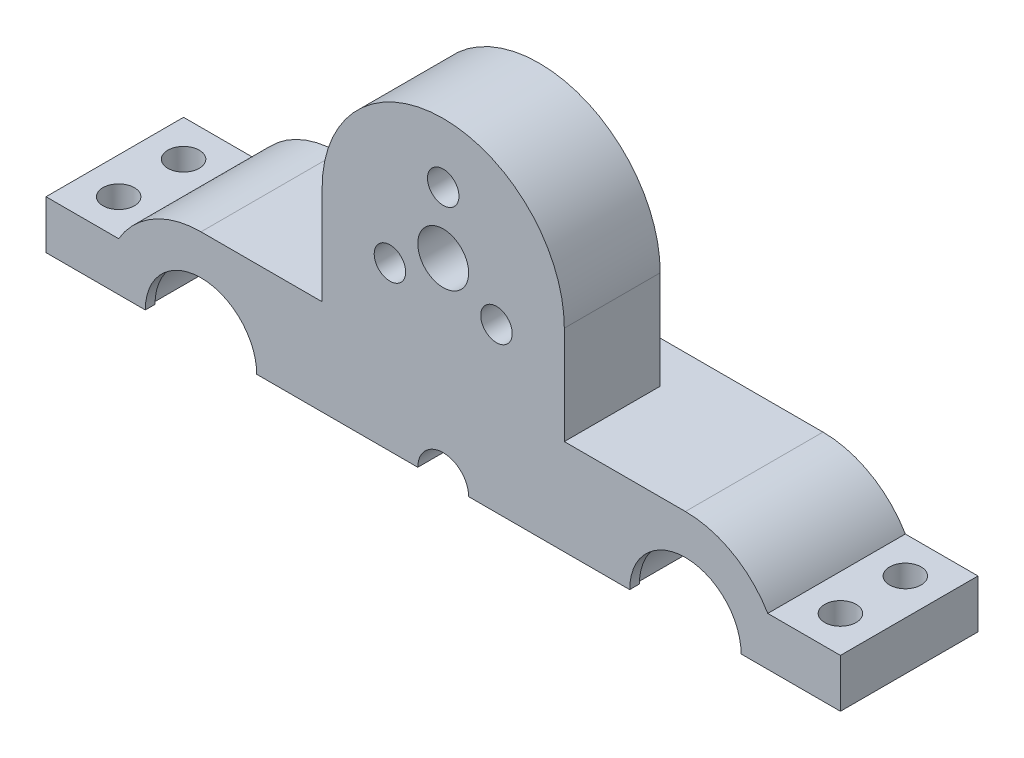
from build123d import *

# Parameters (mm, degrees)
SKETCH1_W           = 82
SKETCH1_H           = 25
BOSS_EXTRUDE1_DEPTH = 14.2
CUT_EXTRUDE3_DEPTH  = 14.2
BOSS_EXTRUDE2_DEPTH = 1
BOSS_EXTRUDE3_START = -13.2
BOSS_EXTRUDE3_DEPTH = 1
CUT_EXTRUDE4_START  = -6.45
CUT_EXTRUDE4_DEPTH  = 3.25
CUT_EXTRUDE5_DEPTH  = 4.5
CUT_EXTRUDE6_DEPTH  = 14.2
SKETCH8_R           = 1.625
CUT_EXTRUDE7_DEPTH  = 5
SKETCH10_W          = 25
SKETCH10_H          = 10.138458538
BOSS_EXTRUDE4_DEPTH = 9.9
SKETCH11_R          = 9.75
CUT_EXTRUDE8_DEPTH  = 4
SKETCH12_R          = 1.625
CUT_EXTRUDE9_DEPTH  = 5.9
CIRPATTERN1_COUNT   = 3
SKETCH13_R          = 2.625
CUT_EXTRUDE10_DEPTH = 5.9


with BuildPart() as part:
    # Sketch1 → Boss-Extrude1 (new body)
    with BuildSketch(Plane.XY):
        with Locations((0, 12.5)):
            Rectangle(SKETCH1_W, SKETCH1_H)
    extrude(amount=BOSS_EXTRUDE1_DEPTH)

    # Sketch2 → Cut-Extrude3 (cut)
    with BuildSketch(Plane(origin=(0, 0, 0), x_dir=(-1, 0, 0), z_dir=(0, 0, -1))):
        with BuildLine():
            Line((-31, 0), (-19, 0))
            ThreePointArc((-19, 0), (-25, 6), (-31, 0))
        make_face()
        with BuildLine():
            Line((19, 0), (31, 0))
            ThreePointArc((31, 0), (25, 6), (19, 0))
        make_face()
    extrude(amount=-CUT_EXTRUDE3_DEPTH, mode=Mode.SUBTRACT)

    # Sketch4 → Boss-Extrude2 (add)
    with BuildSketch(Plane(origin=(0, 0, 0), x_dir=(-1, 0, 0), z_dir=(0, 0, -1))):
        with BuildLine():
            Line((-30.75, 0), (-31, 0))
            ThreePointArc((-31, 0), (-25, 6), (-19, 0))
            Line((-19, 0), (-19.25, 0))
            ThreePointArc((-19.25, 0), (-25, 5.75), (-30.75, 0))
        make_face()
        with BuildLine():
            Line((19, 0), (19.25, 0))
            ThreePointArc((19.25, 0), (25, 5.75), (30.75, 0))
            Line((30.75, 0), (31, 0))
            ThreePointArc((31, 0), (25, 6), (19, 0))
        make_face()
    extrude(amount=-BOSS_EXTRUDE2_DEPTH)

    # Sketch4<2> → Boss-Extrude3 (add)
    with BuildSketch(Plane(origin=(0, 0, 0), x_dir=(-1, 0, 0), z_dir=(0, 0, -1)).offset(BOSS_EXTRUDE3_START)):
        with BuildLine():
            Line((-30.75, 0), (-31, 0))
            ThreePointArc((-31, 0), (-25, 6), (-19, 0))
            Line((-19, 0), (-19.25, 0))
            ThreePointArc((-19.25, 0), (-25, 5.75), (-30.75, 0))
        make_face()
        with BuildLine():
            Line((19, 0), (19.25, 0))
            ThreePointArc((19.25, 0), (25, 5.75), (30.75, 0))
            Line((30.75, 0), (31, 0))
            ThreePointArc((31, 0), (25, 6), (19, 0))
        make_face()
    extrude(amount=-BOSS_EXTRUDE3_DEPTH)

    # Sketch5 → Cut-Extrude4 (cut)
    with BuildSketch(Plane(origin=(0, 0, 0), x_dir=(-1, 0, 0), z_dir=(0, 0, -1)).offset(CUT_EXTRUDE4_START)):
        with BuildLine():
            Line((-6.5, 0), (6.5, 0))
            ThreePointArc((6.5, 0), (0, 6.5), (-6.5, 0))
        make_face()
    extrude(amount=-CUT_EXTRUDE4_DEPTH, mode=Mode.SUBTRACT)

    # Sketch6 → Cut-Extrude5 (cut)
    with BuildSketch(Plane(origin=(0, 0, 14.2), x_dir=(-1, 0, 0), z_dir=(0, 0, -1))):
        with BuildLine():
            Line((-2.625, 0), (2.625, 0))
            ThreePointArc((2.625, 0), (0, 2.625), (-2.625, 0))
        make_face()
    extrude(amount=CUT_EXTRUDE5_DEPTH, mode=Mode.SUBTRACT)

    # Sketch7 → Cut-Extrude6 (cut)
    with BuildSketch(Plane(origin=(0, 0, 0), x_dir=(-1, 0, 0), z_dir=(0, 0, -1))):
        with BuildLine():
            Line((-41, 5), (-33.5, 5))
            ThreePointArc((-33.5, 5), (-29.896033736, 8.560306867), (-25, 9.861541462))
            Line((-25, 9.861541462), (25, 9.861541462))
            ThreePointArc((25, 9.861541462), (29.896033736, 8.560306867), (33.5, 5))
            Line((33.5, 5), (41, 5))
            Line((41, 5), (41, 25))
            Line((41, 25), (-41, 25))
            Line((-41, 25), (-41, 5))
        make_face()
    extrude(amount=-CUT_EXTRUDE6_DEPTH, mode=Mode.SUBTRACT)

    # Sketch8 → Cut-Extrude7 (cut)
    with BuildSketch(Plane(origin=(0, 5, 0), x_dir=(1, 0, 0), z_dir=(0, 1, 0))):
        with Locations(Location((37.25, -3.75, 0), (0, 0, 270))):
            Circle(SKETCH8_R)
        with Locations(Location((37.25, -10.45, 0), (0, 0, 270))):
            Circle(SKETCH8_R)
        with Locations(Location((-37.25, -3.75, 0), (0, 0, 270))):
            Circle(SKETCH8_R)
        with Locations(Location((-37.25, -10.45, 0), (0, 0, 270))):
            Circle(SKETCH8_R)
    extrude(amount=-CUT_EXTRUDE7_DEPTH, mode=Mode.SUBTRACT)

    # Sketch10 → Boss-Extrude4 (add)
    with BuildSketch(Plane.XY.offset(14.2)):
        with Locations((0, 14.930770731)):
            Rectangle(SKETCH10_W, SKETCH10_H)
        with BuildLine():
            Line((-12.5, 20), (12.5, 20))
            ThreePointArc((12.5, 20), (0, 32.5), (-12.5, 20))
        make_face()
    extrude(amount=-BOSS_EXTRUDE4_DEPTH)

    # Sketch11 → Cut-Extrude8 (cut)
    with BuildSketch(Plane(origin=(0, 0, 4.3), x_dir=(-1, 0, 0), z_dir=(0, 0, -1))):
        with Locations((0, 20)):
            Circle(SKETCH11_R)
    extrude(amount=-CUT_EXTRUDE8_DEPTH, mode=Mode.SUBTRACT)

    # Sketch12 → Cut-Extrude9 (cut)
    with BuildSketch(Plane(origin=(0, 0, 8.3), x_dir=(-1, 0, 0), z_dir=(0, 0, -1))):
        with Locations((0, 26.35)):
            Circle(SKETCH12_R)
    cut_extrude9 = extrude(amount=-CUT_EXTRUDE9_DEPTH, mode=Mode.SUBTRACT)

    # CirPattern1: Cut-Extrude9 ×3 about axis
    cirpattern1_axis = Axis((0, 20, 0), (0, 0, 1))
    for i in range(1, CIRPATTERN1_COUNT):
        add(cut_extrude9.rotate(cirpattern1_axis, i * 360 / CIRPATTERN1_COUNT), mode=Mode.SUBTRACT)

    # Sketch13 → Cut-Extrude10 (cut)
    with BuildSketch(Plane(origin=(0, 0, 8.3), x_dir=(-1, 0, 0), z_dir=(0, 0, -1))):
        with Locations((0, 20)):
            Circle(SKETCH13_R)
    extrude(amount=-CUT_EXTRUDE10_DEPTH, mode=Mode.SUBTRACT)


solid = part.part
